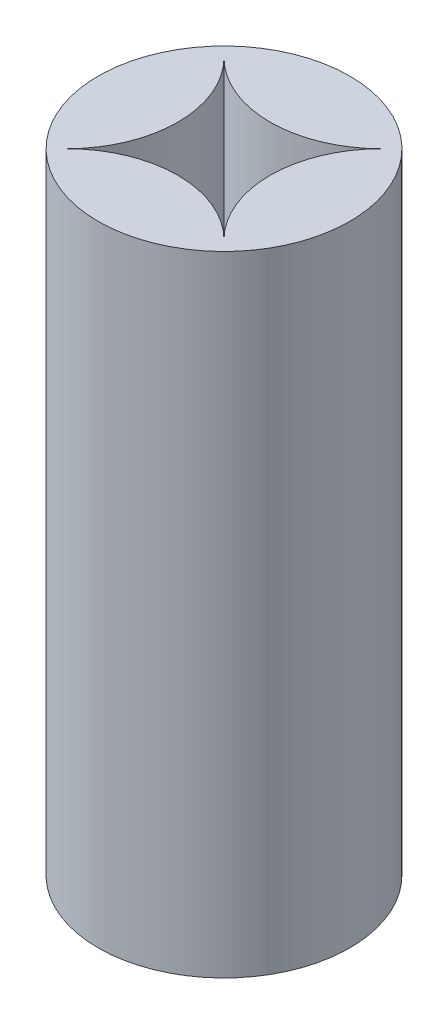
from build123d import *

# Parameters (mm, degrees)
SKETCH1_R           = 4
BOSS_EXTRUDE1_DEPTH = 20


with BuildPart() as part:
    # Sketch1 → Boss-Extrude1 (new body)
    with BuildSketch(Plane(origin=(0, 0, 0), x_dir=(1, 0, 0), z_dir=(0, 1, 0))):
        with Locations(Location((0, 0, 0), (0, 0, 270))):
            Circle(SKETCH1_R)
        with BuildLine():
            ThreePointArc((-2.5, 2.5), (-1.464466094, 0), (-2.5, -2.5))
            ThreePointArc((-2.5, -2.5), (0, -1.464466094), (2.5, -2.5))
            ThreePointArc((2.5, -2.5), (1.464466094, 0), (2.5, 2.5))
            ThreePointArc((2.5, 2.5), (0, 1.464466094), (-2.5, 2.5))
        make_face(mode=Mode.SUBTRACT)
    extrude(amount=BOSS_EXTRUDE1_DEPTH)


solid = part.part
